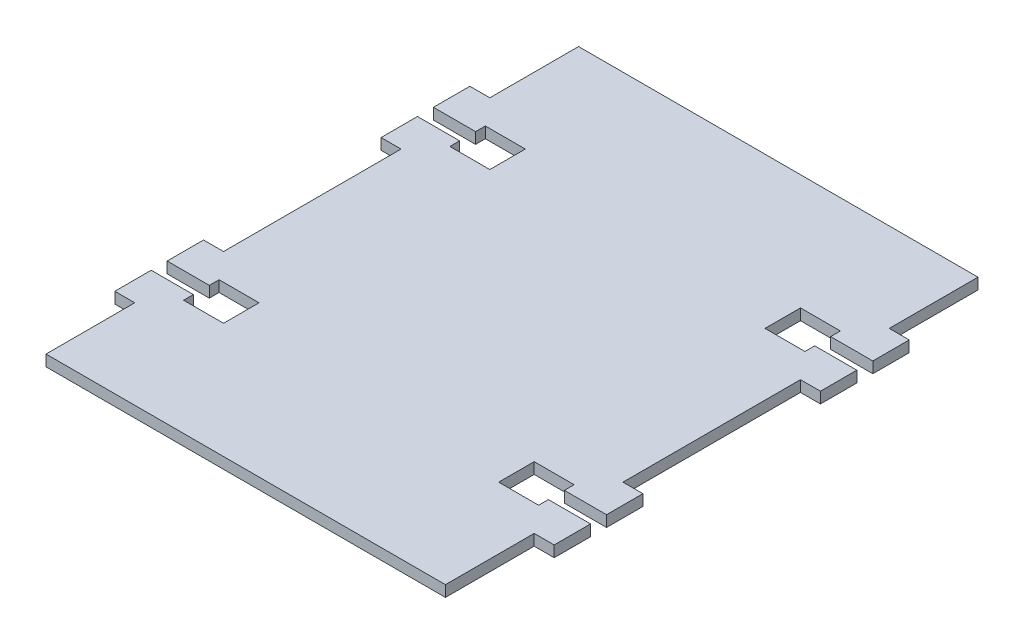
from build123d import *

# Parameters (mm, degrees)
SKETCH1_W           = 90
SKETCH1_H           = 20
SKETCH1_W_2         = 4.5
SKETCH1_H_2         = 8.2
SKETCH1_W_3         = 62
SKETCH1_H_3         = 3.6
SKETCH1_H_4         = 40
BOSS_EXTRUDE1_DEPTH = 2.5


with BuildPart() as part:
    # Sketch1 → Boss-Extrude1 (new body)
    with BuildSketch(Plane(origin=(0, 0, 0), x_dir=(1, 0, 0), z_dir=(0, 1, 0))):
        with Locations((0, 50)):
            Rectangle(SKETCH1_W, SKETCH1_H)
        Polygon((-45, 40), (-45, 31.8), (-40, 31.8), (-40, 34), (-31, 34), (-31, 31.8), (31, 31.8), (31, 34), (40, 34), (40, 31.8), (45, 31.8), (45, 40), align=None)
        with Locations((-47.25, 35.9)):
            Rectangle(SKETCH1_W_2, SKETCH1_H_2)
        with Locations((-47.25, 24.1)):
            Rectangle(SKETCH1_W_2, SKETCH1_H_2)
        Polygon((-45, 28.2), (-45, 20), (45, 20), (45, 28.2), (40, 28.2), (40, 26), (31, 26), (31, 28.2), (-31, 28.2), (-31, 26), (-40, 26), (-40, 28.2), align=None)
        with Locations((0, 30)):
            Rectangle(SKETCH1_W_3, SKETCH1_H_3)
        Rectangle(SKETCH1_W, SKETCH1_H_4)
        Polygon((-45, -20), (-45, -28.2), (-40, -28.2), (-40, -26), (-31, -26), (-31, -28.2), (31, -28.2), (31, -26), (40, -26), (40, -28.2), (45, -28.2), (45, -20), align=None)
        with Locations((-47.25, -24.1)):
            Rectangle(SKETCH1_W_2, SKETCH1_H_2)
        with Locations((-47.25, -35.9)):
            Rectangle(SKETCH1_W_2, SKETCH1_H_2)
        Polygon((-45, -31.8), (-45, -40), (45, -40), (45, -31.8), (40, -31.8), (40, -34), (31, -34), (31, -31.8), (-31, -31.8), (-31, -34), (-40, -34), (-40, -31.8), align=None)
        with Locations((0, -30)):
            Rectangle(SKETCH1_W_3, SKETCH1_H_3)
        with Locations((47.25, -24.1)):
            Rectangle(SKETCH1_W_2, SKETCH1_H_2)
        with Locations((47.25, -35.9)):
            Rectangle(SKETCH1_W_2, SKETCH1_H_2)
        with Locations((47.25, 24.1)):
            Rectangle(SKETCH1_W_2, SKETCH1_H_2)
        with Locations((47.25, 35.9)):
            Rectangle(SKETCH1_W_2, SKETCH1_H_2)
        with Locations((0, -50)):
            Rectangle(SKETCH1_W, SKETCH1_H)
    extrude(amount=BOSS_EXTRUDE1_DEPTH)


solid = part.part
